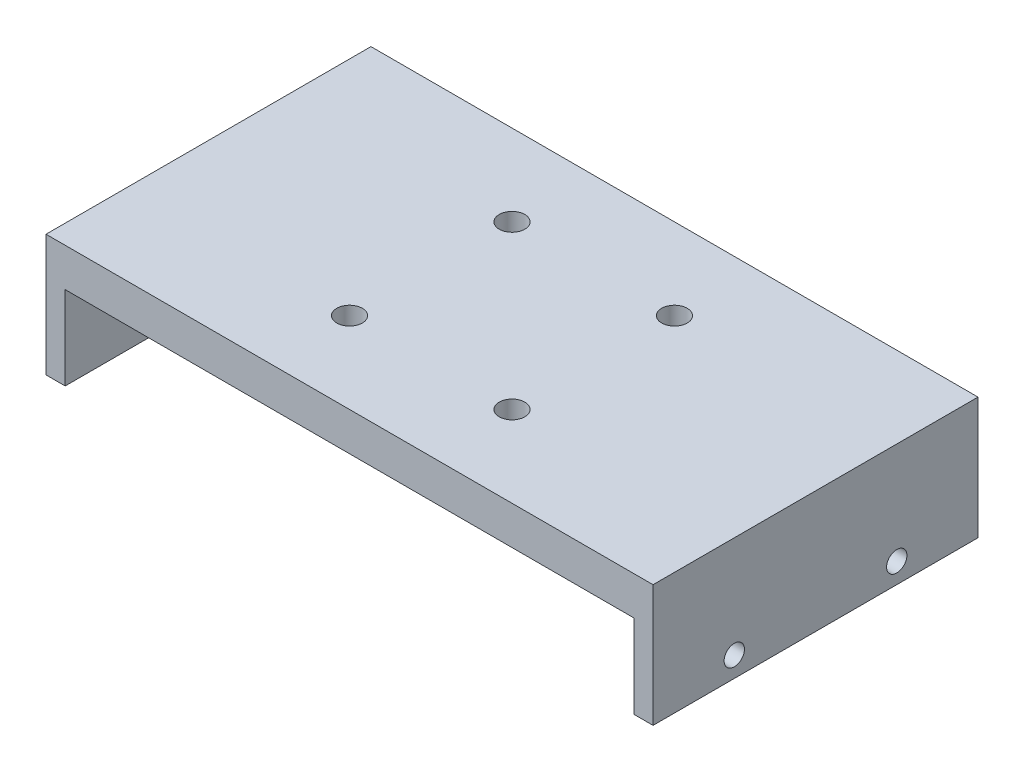
from build123d import *

# Parameters (mm, degrees)
SKETCH1_W           = 88.9
SKETCH1_H           = 50.8
BOSS_EXTRUDE1_DEPTH = 6
SKETCH2_W           = 50.8
SKETCH2_H           = 19.05
BOSS_EXTRUDE2_DEPTH = 3
SKETCH3_R           = 1.5875
CUT_EXTRUDE1_DEPTH  = 97.234466279
SKETCH4_R           = 2
CUT_EXTRUDE2_DEPTH  = 58.092600221


with BuildPart() as part:
    # Sketch1 → Boss-Extrude1 (new body)
    with BuildSketch(Plane(origin=(0, 0, 0), x_dir=(1, 0, 0), z_dir=(0, 1, 0))):
        Rectangle(SKETCH1_W, SKETCH1_H)
    extrude(amount=BOSS_EXTRUDE1_DEPTH)

    # Sketch2 → Boss-Extrude2 (add)
    with BuildSketch(Plane.ZY.offset(44.45)):
        with Locations((0, -3.525)):
            Rectangle(SKETCH2_W, SKETCH2_H)
    boss_extrude2 = extrude(amount=BOSS_EXTRUDE2_DEPTH)

    # Sketch3 → Cut-Extrude1 (cut, through all)
    with BuildSketch(Plane.ZY.offset(47.45)):
        with Locations((-12.7, -9.875)):
            Circle(SKETCH3_R)
        with Locations((12.7, -9.875)):
            Circle(SKETCH3_R)
    cut_extrude1 = extrude(amount=-CUT_EXTRUDE1_DEPTH, mode=Mode.SUBTRACT)

    # Mirror1: Boss-Extrude2, Cut-Extrude1 across plane
    add(boss_extrude2.mirror(Plane(origin=(0, 0, 0), x_dir=(0, 0, 1), z_dir=(1, 0, 0))))
    add(cut_extrude1.mirror(Plane(origin=(0, 0, 0), x_dir=(0, 0, 1), z_dir=(1, 0, 0))), mode=Mode.SUBTRACT)

    # Sketch4 → Cut-Extrude2 (cut, through all)
    with BuildSketch(Plane(origin=(0, 6, 0), x_dir=(1, 0, 0), z_dir=(0, 1, 0))):
        with Locations(Location((-12.7, 12.7, 0), (0, 0, 270))):
            Circle(SKETCH4_R)
        with Locations(Location((12.7, 12.7, 0), (0, 0, 270))):
            Circle(SKETCH4_R)
        with Locations(Location((-12.7, -12.7, 0), (0, 0, 270))):
            Circle(SKETCH4_R)
        with Locations(Location((12.7, -12.7, 0), (0, 0, 270))):
            Circle(SKETCH4_R)
    extrude(amount=-CUT_EXTRUDE2_DEPTH, mode=Mode.SUBTRACT)


solid = part.part
